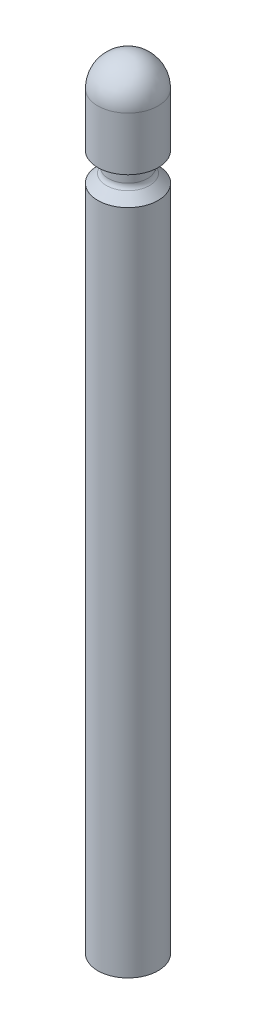
from build123d import *

# Parameters (mm, degrees)
SKETCH1_R           = 3.3655
BOSS_EXTRUDE1_DEPTH = 86.91372
FILLET1_R           = 3.3655


with BuildPart() as part:
    # Sketch1 → Boss-Extrude1 (new body)
    with BuildSketch(Plane(origin=(0, 0, 0), x_dir=(1, 0, 0), z_dir=(0, 1, 0))):
        with Locations(Location((0, 0, 0), (0, 0, 270))):
            Circle(SKETCH1_R)
    extrude(amount=BOSS_EXTRUDE1_DEPTH)

    # Sketch2 → Cut-Revolve2 (revolve, cut)
    with BuildSketch(Plane(origin=(48.790895882, 11.267332823, -12.664317923), x_dir=(0.9679254058512238, 0, -0.2512377533487826), z_dir=(0.2512377533487826, 0, 0.9679254058512238)), mode=Mode.PRIVATE) as cut_revolve2_sk:
        with BuildLine():
            Line((-53.773202481, 66.327127177), (-53.376327481, 66.327127177))
            ThreePointArc((-53.376327481, 66.327127177), (-52.815061473, 66.094643184), (-52.582577481, 65.533377177))
            Line((-52.582577481, 65.533377177), (-52.582577481, 64.671534192))
            ThreePointArc((-52.582577481, 64.671534192), (-52.642998102, 64.367779217), (-52.815061473, 64.110268184))
            Line((-52.815061473, 64.110268184), (-53.773202481, 63.152127177))
            Line((-53.773202481, 63.152127177), (-53.773202481, 66.327127177))
        make_face()
    revolve(cut_revolve2_sk.sketch.rotate(Axis((0, 86.91372, 0), (0, -1, 0)), 14.550768137), axis=Axis((0, 86.91372, 0), (0, -1, 0)), mode=Mode.SUBTRACT)

    # Fillet1
    fillet1_edges = [part.edges().sort_by_distance(p)[0] for p in [
        (0, 86.91372, -3.3655),
    ]]
    fillet(fillet1_edges, radius=FILLET1_R)


solid = part.part
